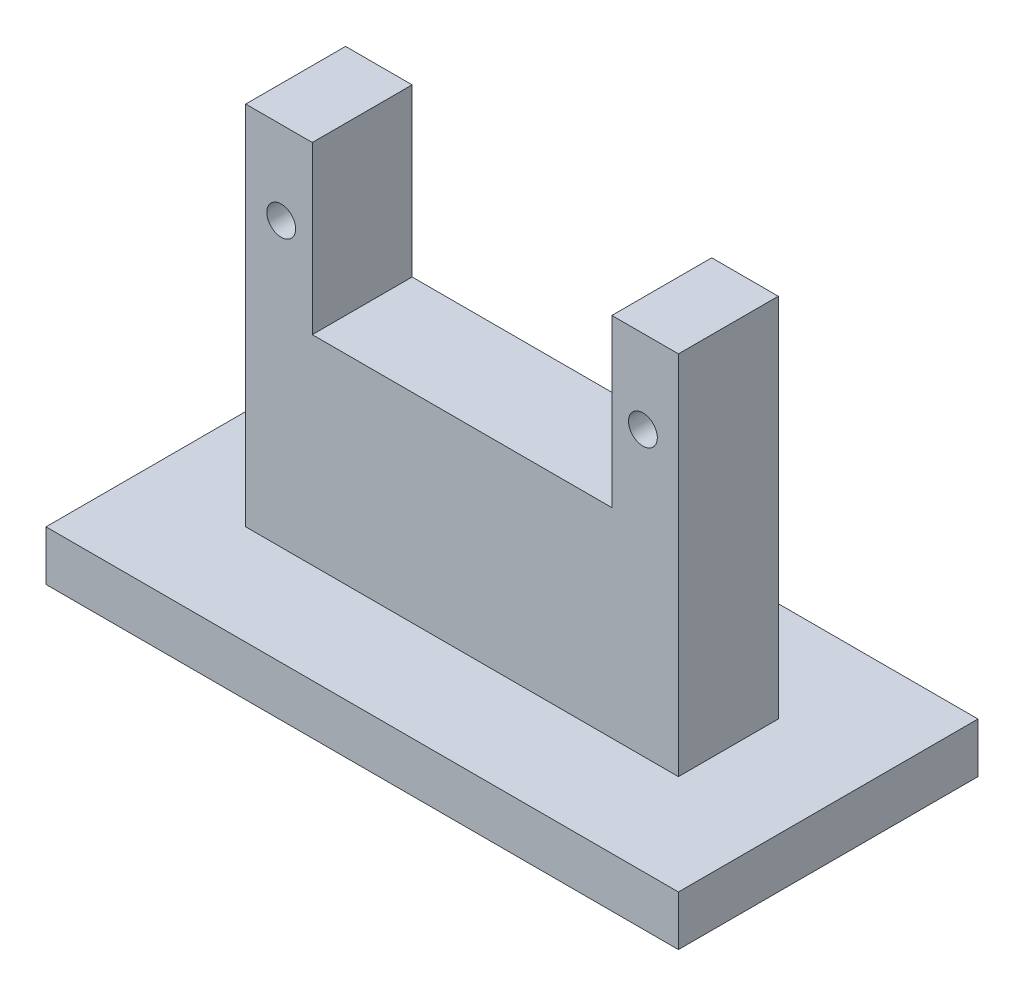
from build123d import *

# Parameters (mm, degrees)
BOSS_EXTRUDE4_DEPTH  = 7.62
SKETCH7_W            = 48.26
SKETCH7_H            = 22.86
BOSS_EXTRUDE5_DEPTH  = 3.81
M2_CLEARANCE_HOLE1_D = 2.2


with BuildPart() as part:
    # Sketch6 → Boss-Extrude4 (new body)
    with BuildSketch(Plane.XY):
        Polygon((-11.43, 19.05), (11.43, 19.05), (11.43, 31.75), (16.51, 31.75), (16.51, 0), (-16.51, 0), (-16.51, 31.75), (-11.43, 31.75), align=None)
    extrude(amount=BOSS_EXTRUDE4_DEPTH)

    # Sketch7 → Boss-Extrude5 (add)
    with BuildSketch(Plane(origin=(0, 0, 0), x_dir=(1, 0, 0), z_dir=(0, 1, 0))):
        with Locations((0, -3.81)):
            Rectangle(SKETCH7_W, SKETCH7_H)
    extrude(amount=BOSS_EXTRUDE5_DEPTH)

    # M2 Clearance Hole1 (through all)
    with Locations(Plane(origin=(0, 0, 0), x_dir=(-1, 0, 0), z_dir=(0, 0, -1))):
        with Locations((-13.8, 25.4), (13.8, 25.4)):
            Hole(M2_CLEARANCE_HOLE1_D / 2)


solid = part.part
